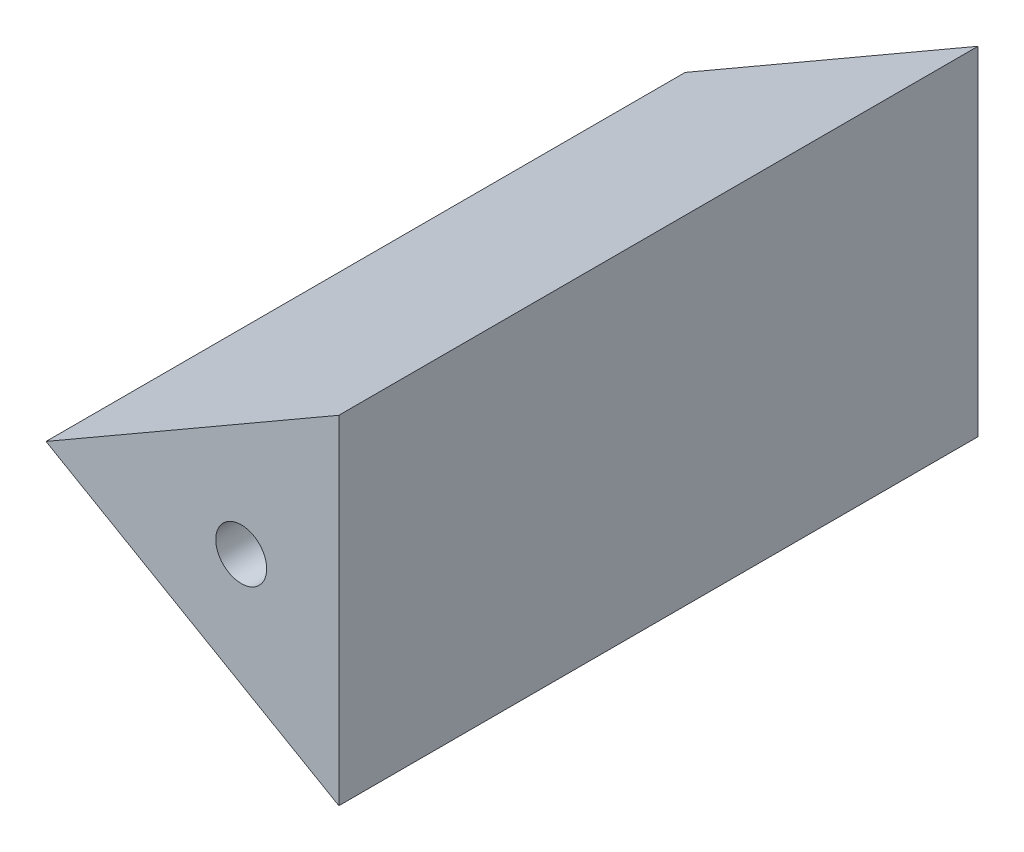
from build123d import *

# Parameters (mm, degrees)
BOSS_EXTRUDE2_DEPTH = 100
SKETCH3_R           = 3.982149342
CUT_EXTRUDE1_DEPTH  = 100


with BuildPart() as part:
    # Sketch2 → Boss-Extrude2 (new body)
    with BuildSketch(Plane.XY):
        Polygon((15.272915778, 26.453466107), (-30.545831555, 0), (15.272915778, -26.453466107), align=None)
    extrude(amount=BOSS_EXTRUDE2_DEPTH)

    # Sketch3 → Cut-Extrude1 (cut)
    with BuildSketch(Plane.XY.offset(100)):
        Circle(SKETCH3_R)
    extrude(amount=-CUT_EXTRUDE1_DEPTH, mode=Mode.SUBTRACT)


solid = part.part
